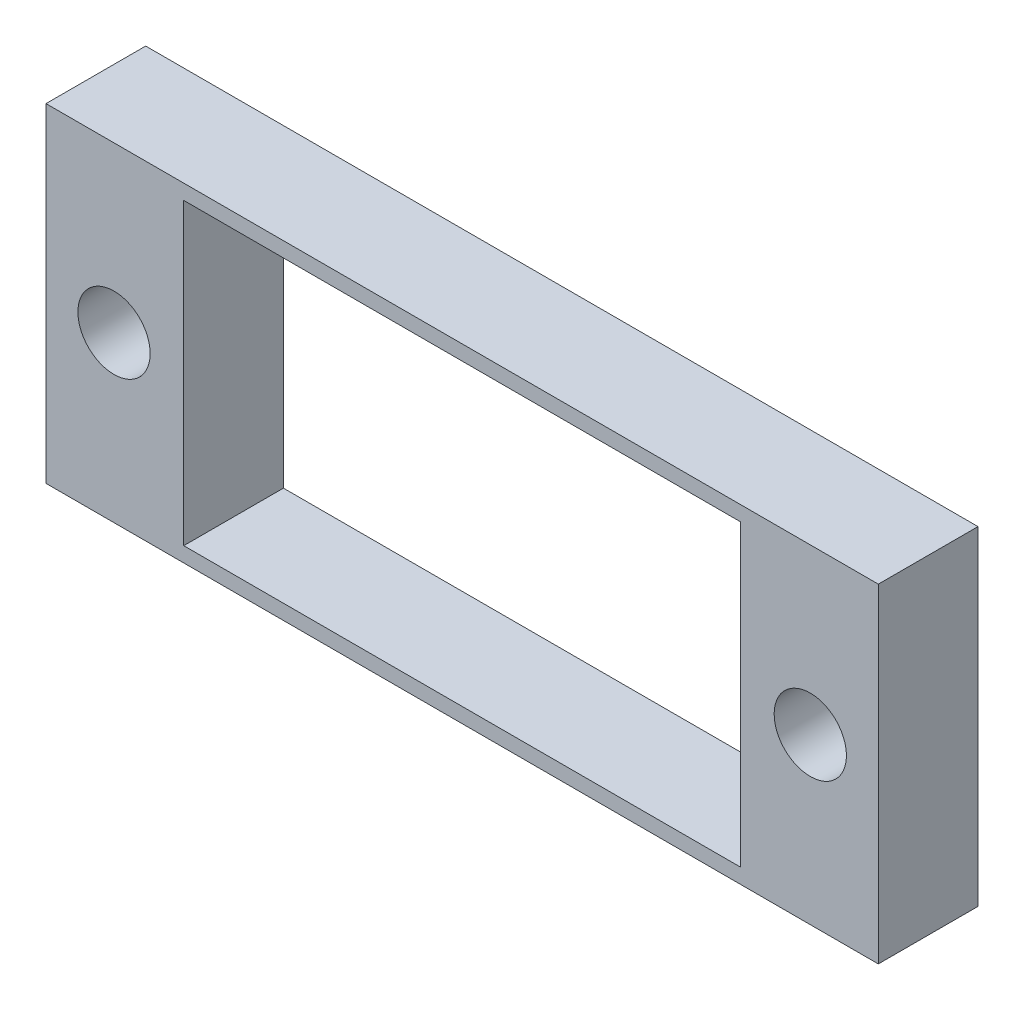
from build123d import *

# Parameters (mm, degrees)
SKETCH1_W            = 33.4
SKETCH1_H            = 13.2
SKETCH1_W_2          = 32.2
SKETCH1_H_2          = 12
BOSS_EXTRUDE3_DEPTH  = 4
SKETCH3_W            = 4.9276
SKETCH3_H            = 12
BOSS_EXTRUDE4_DEPTH  = 4
SKETCH4_R            = 1.45
MOUNTING_HOLES_DEPTH = 19.397010627


with BuildPart() as part:
    # Sketch1 → Boss-Extrude3 (new body)
    with BuildSketch(Plane.XY):
        Rectangle(SKETCH1_W, SKETCH1_H)
        Rectangle(SKETCH1_W_2, SKETCH1_H_2, mode=Mode.SUBTRACT)
    extrude(amount=BOSS_EXTRUDE3_DEPTH)

    # Sketch3 → Boss-Extrude4 (add, through all)
    with BuildSketch(Plane.XY.offset(4)):
        with Locations((-13.6362, 0)):
            Rectangle(SKETCH3_W, SKETCH3_H)
        with Locations((13.6362, 0)):
            Rectangle(SKETCH3_W, SKETCH3_H)
    extrude(amount=-BOSS_EXTRUDE4_DEPTH)

    # Sketch4 → mounting holes (cut, through all)
    with BuildSketch(Plane.XY.offset(4)):
        with Locations((-13.97, 0)):
            Circle(SKETCH4_R)
        with Locations(Location((13.97, 0, 0), (0, 0, 180))):
            Circle(SKETCH4_R)
    extrude(amount=-MOUNTING_HOLES_DEPTH, mode=Mode.SUBTRACT)


solid = part.part
